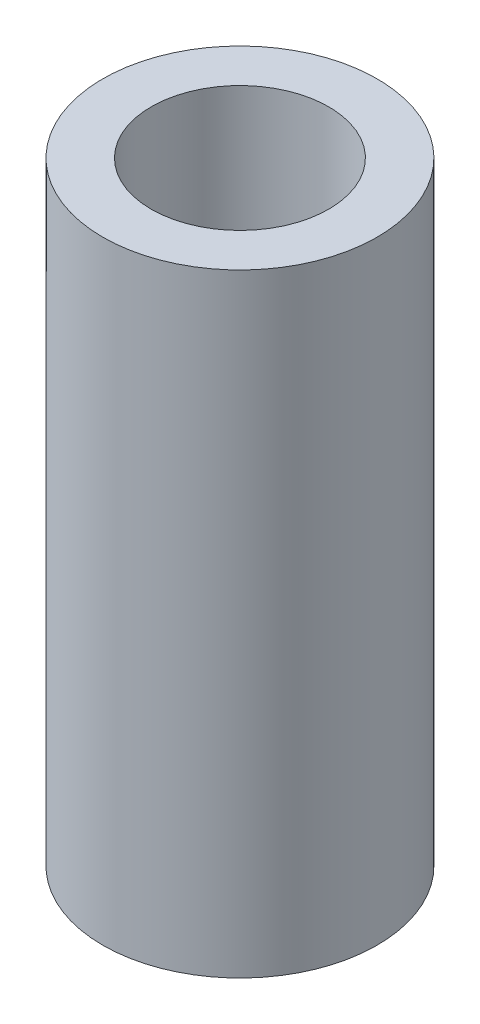
from build123d import *

# Parameters (mm, degrees)
SKETCH_1_R      = 4.25
SKETCH_1_R_2    = 2.75
EXTRUDE_1_DEPTH = 19


with BuildPart() as part:
    # 草图1 → 凸台-拉伸1 (new body)
    with BuildSketch(Plane(origin=(0, 0, 0), x_dir=(1, 0, 0), z_dir=(0, 1, 0))):
        with Locations(Location((0, 0, 0), (0, 0, 270))):
            Circle(SKETCH_1_R)
        with Locations(Location((0, 0, 0), (0, 0, 270))):
            Circle(SKETCH_1_R_2, mode=Mode.SUBTRACT)
    extrude(amount=EXTRUDE_1_DEPTH)


solid = part.part
